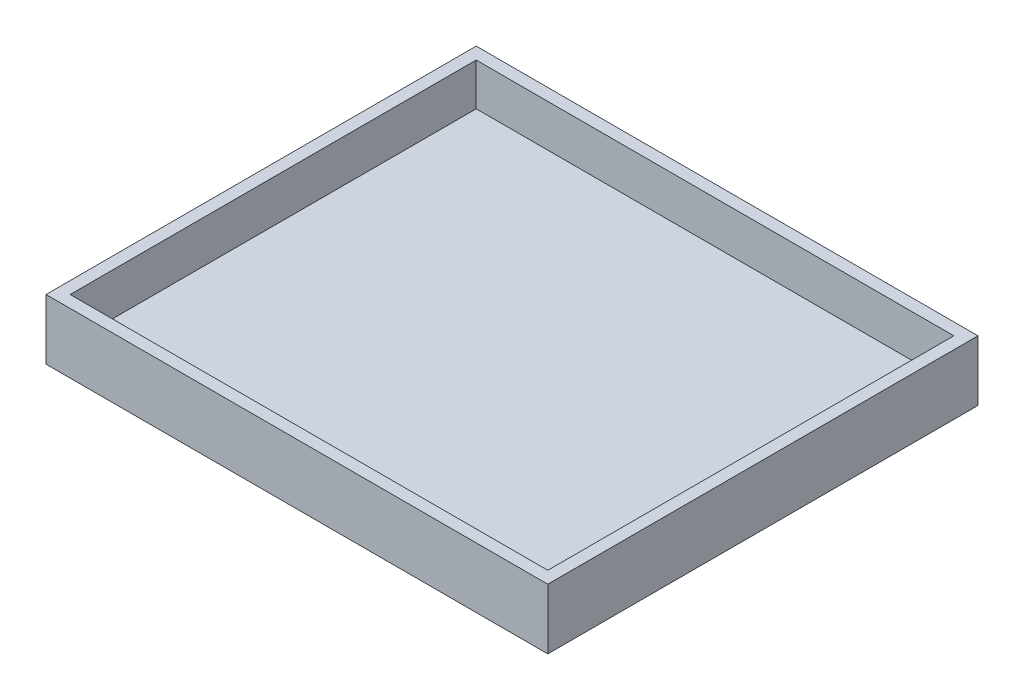
from build123d import *

# Parameters (mm, degrees)
SKETCH1_W           = 83.14
SKETCH1_H           = 71.281576044
BOSS_EXTRUDE1_DEPTH = 10
SKETCH2_W           = 79.14
SKETCH2_H           = 67.281576044
CUT_EXTRUDE1_DEPTH  = 7


with BuildPart() as part:
    # Sketch1 → Boss-Extrude1 (new body)
    with BuildSketch(Plane(origin=(0, 0, 0), x_dir=(1, 0, 0), z_dir=(0, 1, 0))):
        Rectangle(SKETCH1_W, SKETCH1_H)
    extrude(amount=BOSS_EXTRUDE1_DEPTH)

    # Sketch2 → Cut-Extrude1 (cut)
    with BuildSketch(Plane(origin=(0, 10, 0), x_dir=(1, 0, 0), z_dir=(0, 1, 0))):
        Rectangle(SKETCH2_W, SKETCH2_H)
    extrude(amount=-CUT_EXTRUDE1_DEPTH, mode=Mode.SUBTRACT)


solid = part.part
